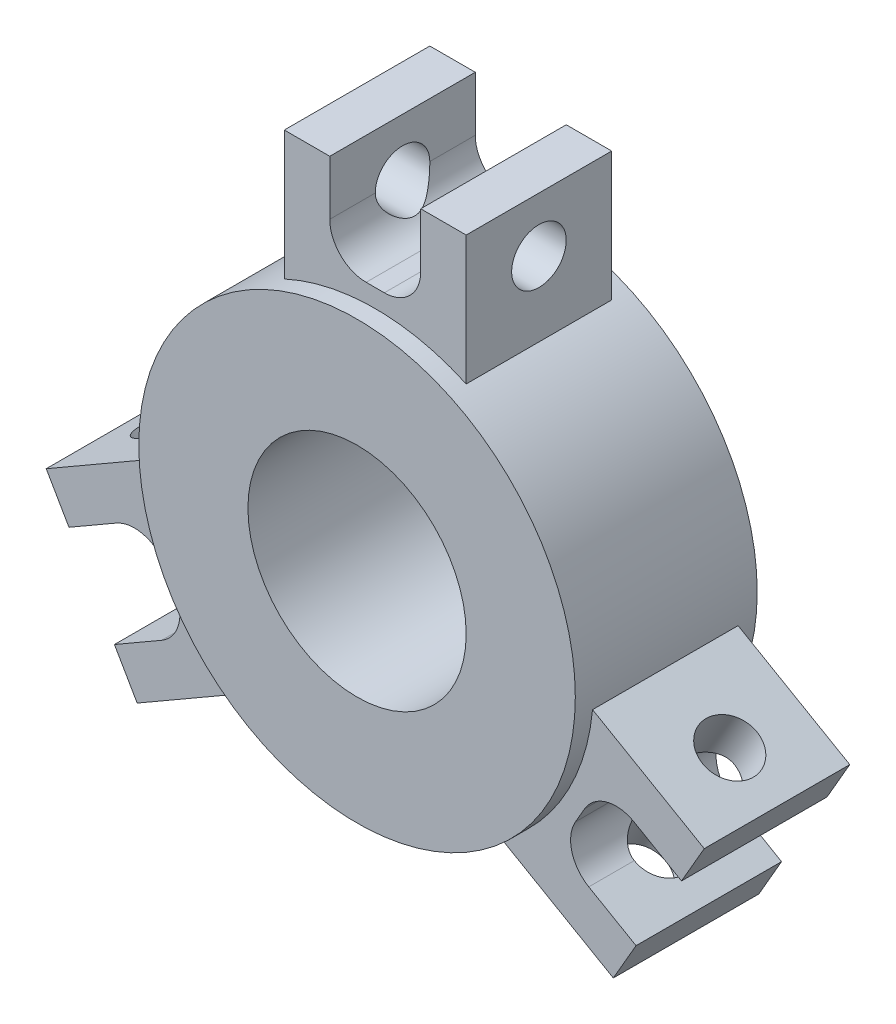
from build123d import *

# Parameters (mm, degrees)
CROQUIS1_R              = 6
CROQUIS1_R_2            = 3
SALIENTE_EXTRUIR1_DEPTH = 2.5
CROQUIS3_W              = 4
CROQUIS3_H              = 4
CROQUIS3_R              = 0.75
SALIENTE_EXTRUIR2_DEPTH = 2.5
CORTAR_EXTRUIR1_DEPTH   = 5
MATRIZC1_COUNT          = 3


with BuildPart() as part:
    # Croquis1 → Saliente-Extruir1 (new, symmetric)
    with BuildSketch(Plane.XY):
        Circle(CROQUIS1_R)
        Circle(CROQUIS1_R_2, mode=Mode.SUBTRACT)
    extrude(amount=SALIENTE_EXTRUIR1_DEPTH, both=True)

    # Croquis3 → Saliente-Extruir2 (add, symmetric)
    with BuildSketch(Plane(origin=(0, 0, 0), x_dir=(0, 0, -1), z_dir=(1, 0, 0))):
        with Locations((0, 7)):
            Rectangle(CROQUIS3_W, CROQUIS3_H)
        with Locations((0, 7.5)):
            Circle(CROQUIS3_R, mode=Mode.SUBTRACT)
    saliente_extruir2 = extrude(amount=SALIENTE_EXTRUIR2_DEPTH, both=True)

    # Croquis4 → Cortar-Extruir1 (cut)
    with BuildSketch(Plane.XY.offset(2)):
        with BuildLine():
            Line((-1.25, 9), (1.25, 9))
            Line((1.25, 9), (1.25, 7.5))
            ThreePointArc((1.25, 7.5), (0.957106781, 6.792893219), (0.25, 6.5))
            Line((0.25, 6.5), (-0.25, 6.5))
            ThreePointArc((-0.25, 6.5), (-0.957106781, 6.792893219), (-1.25, 7.5))
            Line((-1.25, 7.5), (-1.25, 9))
        make_face()
    cortar_extruir1 = extrude(amount=-CORTAR_EXTRUIR1_DEPTH, mode=Mode.SUBTRACT)

    # MatrizC1: Saliente-Extruir2, Cortar-Extruir1 ×3 about axis
    matrizc1_axis = Axis((0, 0, 0), (0, 0, 1))
    add([saliente_extruir2.rotate(matrizc1_axis, i * 360 / MATRIZC1_COUNT) for i in range(1, MATRIZC1_COUNT)])
    add([cortar_extruir1.rotate(matrizc1_axis, i * 360 / MATRIZC1_COUNT) for i in range(1, MATRIZC1_COUNT)], mode=Mode.SUBTRACT)


solid = part.part
